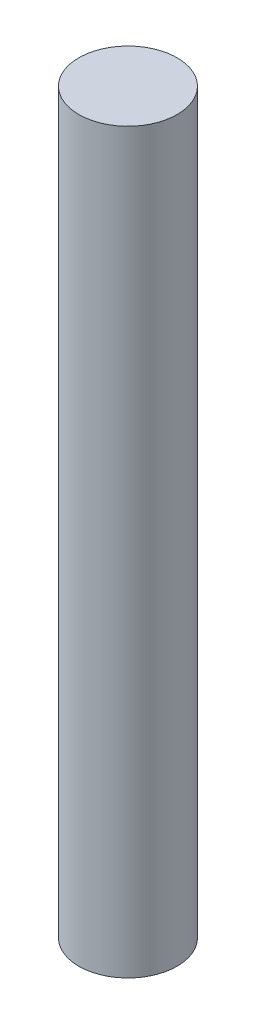
from build123d import *

# Parameters (mm, degrees)
SKETCH1_R           = 8
BOSS_EXTRUDE1_DEPTH = 60


with BuildPart() as part:
    # Sketch1 → Boss-Extrude1 (new, symmetric)
    with BuildSketch(Plane(origin=(0, 0, 0), x_dir=(1, 0, 0), z_dir=(0, 1, 0))):
        with Locations(Location((0, 0, 0), (0, 0, 270))):
            Circle(SKETCH1_R)
    extrude(amount=BOSS_EXTRUDE1_DEPTH, both=True)


solid = part.part
